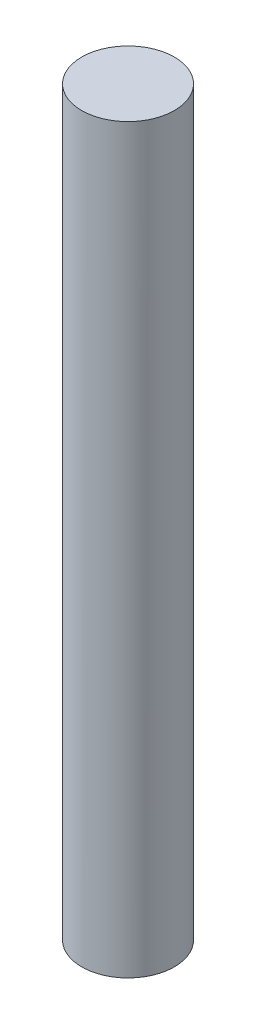
from build123d import *

# Parameters (mm, degrees)
IZIM1_R                     = 7.5
Y_KSEKLIK_EKSTR_ZYON1_DEPTH = 40
Y_KSEKLIK_EKSTR_ZYON2_START = 80
IZIM2_R                     = 7.5
Y_KSEKLIK_EKSTR_ZYON2_DEPTH = 80


with BuildPart() as part:
    # Çizim1 → Yükseklik-Ekstrüzyon1 (new body)
    with BuildSketch(Plane(origin=(0, 0, 0), x_dir=(1, 0, 0), z_dir=(0, 1, 0))):
        with Locations(Location((0, 0, 0), (0, 0, 270))):
            Circle(IZIM1_R)
    extrude(amount=Y_KSEKLIK_EKSTR_ZYON1_DEPTH)

    # Çizim2 → Yükseklik-Ekstrüzyon2 (add)
    with BuildSketch(Plane.XZ.offset(Y_KSEKLIK_EKSTR_ZYON2_START)):
        with Locations(Location((0, 0, 0), (0, 0, 270))):
            Circle(IZIM2_R)
    extrude(amount=-Y_KSEKLIK_EKSTR_ZYON2_DEPTH)


solid = part.part
